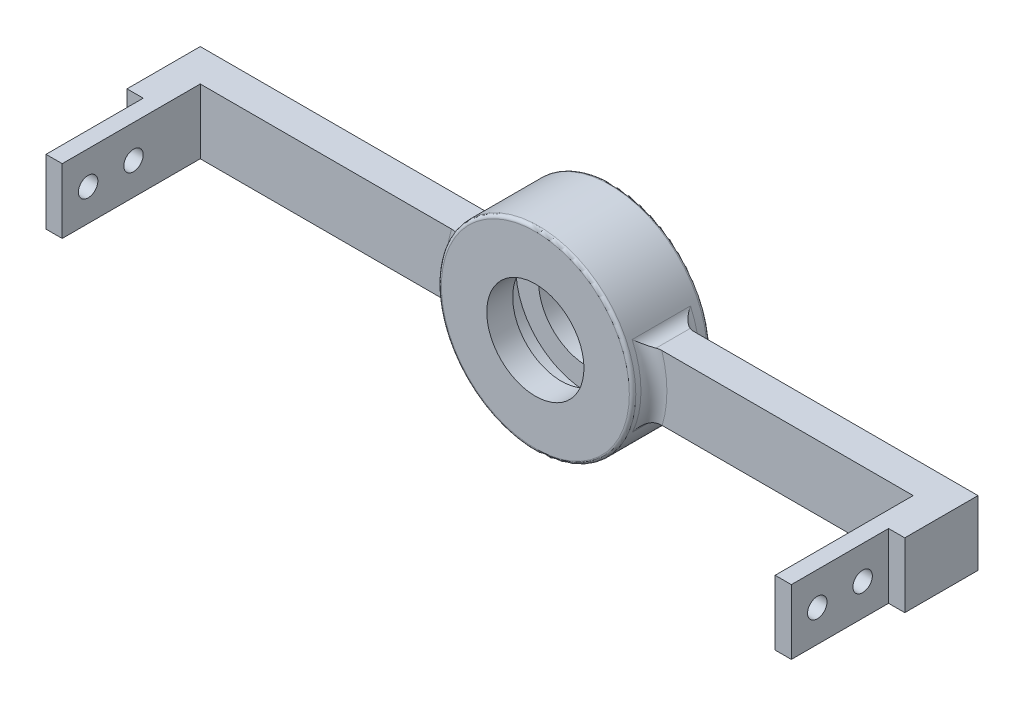
from build123d import *

# Parameters (mm, degrees)
SKETCH7_R            = 15
BOSS_EXTRUDE2_DEPTH  = 12
SKETCH9_R            = 11
CUT_EXTRUDE1_DEPTH   = 4
SKETCH8_R            = 7.5
CUT_EXTRUDE2_DEPTH   = 20
BOSS_EXTRUDE4_START  = -3
SKETCH11_W           = 5
SKETCH11_H           = 10
BOSS_EXTRUDE4_DEPTH  = 48
SKETCH14_W           = 5
SKETCH14_H           = 10
BOSS_EXTRUDE5_DEPTH  = 6.3
SKETCH17_W           = 2.5
SKETCH17_H           = 10
BOSS_EXTRUDE8_DEPTH  = 15
SKETCH20_R           = 1.5
CUT_EXTRUDE3_DEPTH   = 15
FILLET2_R            = 2
FILLET7_R            = 0.5
FILLET8_R            = 0.5
FILLET2_OF_MIRROR5_R = 2


with BuildPart() as part:
    # Sketch7 → Boss-Extrude2 (new body)
    with BuildSketch(Plane.XY.offset(37)):
        Circle(SKETCH7_R)
    extrude(amount=-BOSS_EXTRUDE2_DEPTH)

    # Sketch9 → Cut-Extrude1 (cut)
    with BuildSketch(Plane.XY.offset(33)):
        Circle(SKETCH9_R)
    extrude(amount=-CUT_EXTRUDE1_DEPTH, mode=Mode.SUBTRACT)

    # Sketch8 → Cut-Extrude2 (cut)
    with BuildSketch(Plane.XY.offset(37)):
        Circle(SKETCH8_R)
    extrude(amount=-CUT_EXTRUDE2_DEPTH, mode=Mode.SUBTRACT)

    # Sketch11 → Boss-Extrude4 (add)
    with BuildSketch(Plane(origin=(15, 0, 0), x_dir=(0, 0, -1), z_dir=(1, 0, 0)).offset(BOSS_EXTRUDE4_START)):
        with Locations((-31.203319291, 0.070417763)):
            Rectangle(SKETCH11_W, SKETCH11_H)
    boss_extrude4 = extrude(amount=BOSS_EXTRUDE4_DEPTH)

    # Sketch14 → Boss-Extrude5 (add)
    with BuildSketch(Plane.XY.offset(33.703319291)):
        with Locations((57.5, 0.070417763)):
            Rectangle(SKETCH14_W, SKETCH14_H)
    boss_extrude5 = extrude(amount=BOSS_EXTRUDE5_DEPTH)

    # Sketch17 → Boss-Extrude8 (add)
    with BuildSketch(Plane.XY.offset(40.003319291)):
        with Locations((56.25, 0.070417763)):
            Rectangle(SKETCH17_W, SKETCH17_H)
    boss_extrude8 = extrude(amount=BOSS_EXTRUDE8_DEPTH)

    # Sketch20 → Cut-Extrude3 (cut)
    with BuildSketch(Plane(origin=(57.5, 0, 0), x_dir=(0, 0, -1), z_dir=(1, 0, 0))):
        with Locations((-44.003319291, 0)):
            Circle(SKETCH20_R)
        with Locations((-51.003319291, 0)):
            Circle(SKETCH20_R)
    cut_extrude3 = extrude(amount=-CUT_EXTRUDE3_DEPTH, mode=Mode.SUBTRACT)

    # Fillet2
    fillet2_edges = [part.edges().sort_by_distance(p)[0] for p in [
        (14.166835178, -4.929582237, 31.203319291),
        (14.777611852, 2.573361217, 28.703319291),
        (14.117041606, 5.070417763, 31.203319291),
        (14.777611852, 2.573361217, 33.703319291),
    ]]
    fillet(fillet2_edges, radius=FILLET2_R)

    # Fillet7
    fillet7_edges = [part.edges().sort_by_distance(p)[0] for p in [
        (-15, 0, 37),
    ]]
    fillet(fillet7_edges, radius=FILLET7_R)

    # Fillet8
    fillet8_edges = [part.edges().sort_by_distance(p)[0] for p in [
        (-15, 0, 25),
    ]]
    fillet(fillet8_edges, radius=FILLET8_R)

    # Mirror5: Boss-Extrude4, Boss-Extrude5, Boss-Extrude8, Cut-Extrude3 across plane
    add(boss_extrude4.mirror(Plane(origin=(0, 0, 0), x_dir=(0, 0, 1), z_dir=(1, 0, 0))))
    add(boss_extrude5.mirror(Plane(origin=(0, 0, 0), x_dir=(0, 0, 1), z_dir=(1, 0, 0))))
    add(boss_extrude8.mirror(Plane(origin=(0, 0, 0), x_dir=(0, 0, 1), z_dir=(1, 0, 0))))
    add(cut_extrude3.mirror(Plane(origin=(0, 0, 0), x_dir=(0, 0, 1), z_dir=(1, 0, 0))), mode=Mode.SUBTRACT)

    # Fillet2 of Mirror5
    fillet2_of_mirror5_edges = [part.edges().sort_by_distance(p)[0] for p in [
        (-14.166835178, -4.929582237, 31.203319291),
        (-14.777611852, 2.573361217, 28.703319291),
        (-14.117041606, 5.070417763, 31.203319291),
        (-14.777611852, 2.573361217, 33.703319291),
    ]]
    fillet(fillet2_of_mirror5_edges, radius=FILLET2_OF_MIRROR5_R)


solid = part.part
